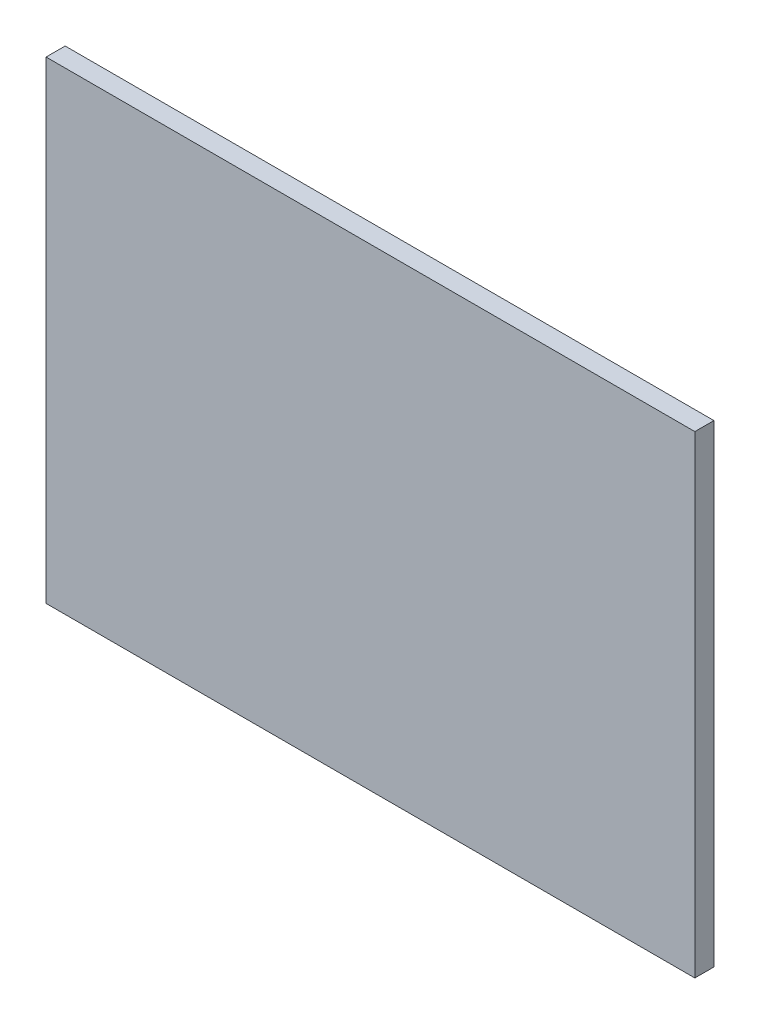
from build123d import *

# Parameters (mm, degrees)
ESQUISSE1_W        = 170
ESQUISSE1_H        = 124
BOSS_EXTRU_1_DEPTH = 5


with BuildPart() as part:
    # Esquisse1 → Boss.-Extru.1 (new body)
    with BuildSketch(Plane.XY):
        with Locations((85, 62)):
            Rectangle(ESQUISSE1_W, ESQUISSE1_H)
    extrude(amount=BOSS_EXTRU_1_DEPTH)


solid = part.part
